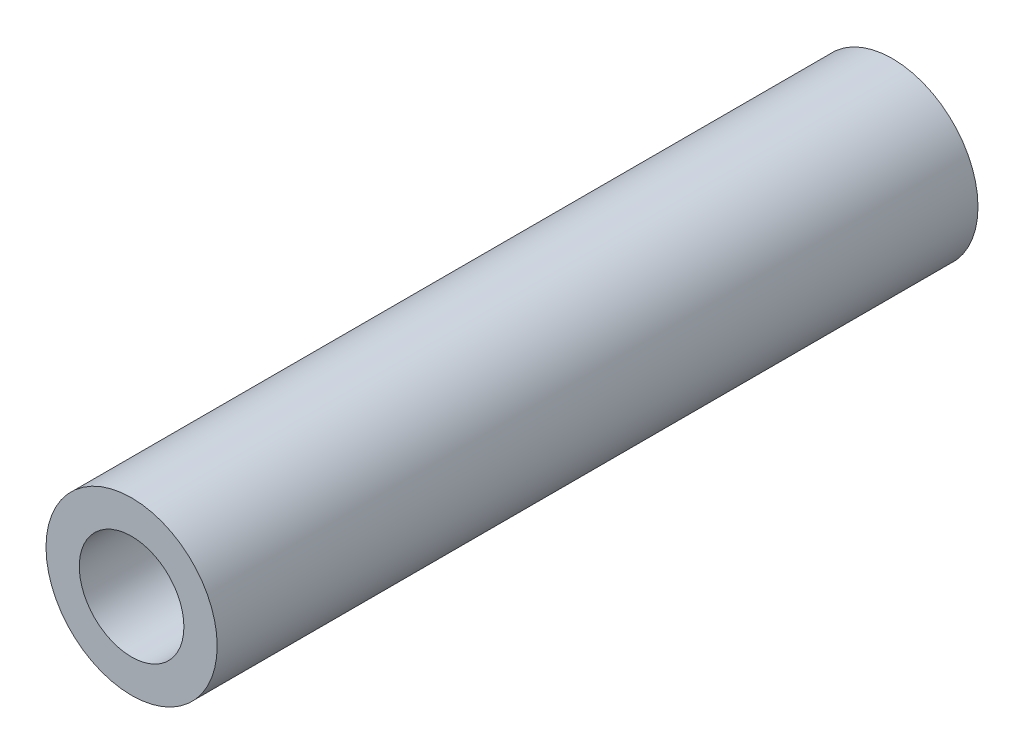
from build123d import *

# Parameters (mm, degrees)
SKETCH_1_R      = 3.6
SKETCH_1_R_2    = 2.2
EXTRUDE_1_DEPTH = 16


with BuildPart() as part:
    # 草图1 → 凸台-拉伸1 (new, symmetric)
    with BuildSketch(Plane.XY):
        Circle(SKETCH_1_R)
        Circle(SKETCH_1_R_2, mode=Mode.SUBTRACT)
    extrude(amount=EXTRUDE_1_DEPTH, both=True)


solid = part.part
